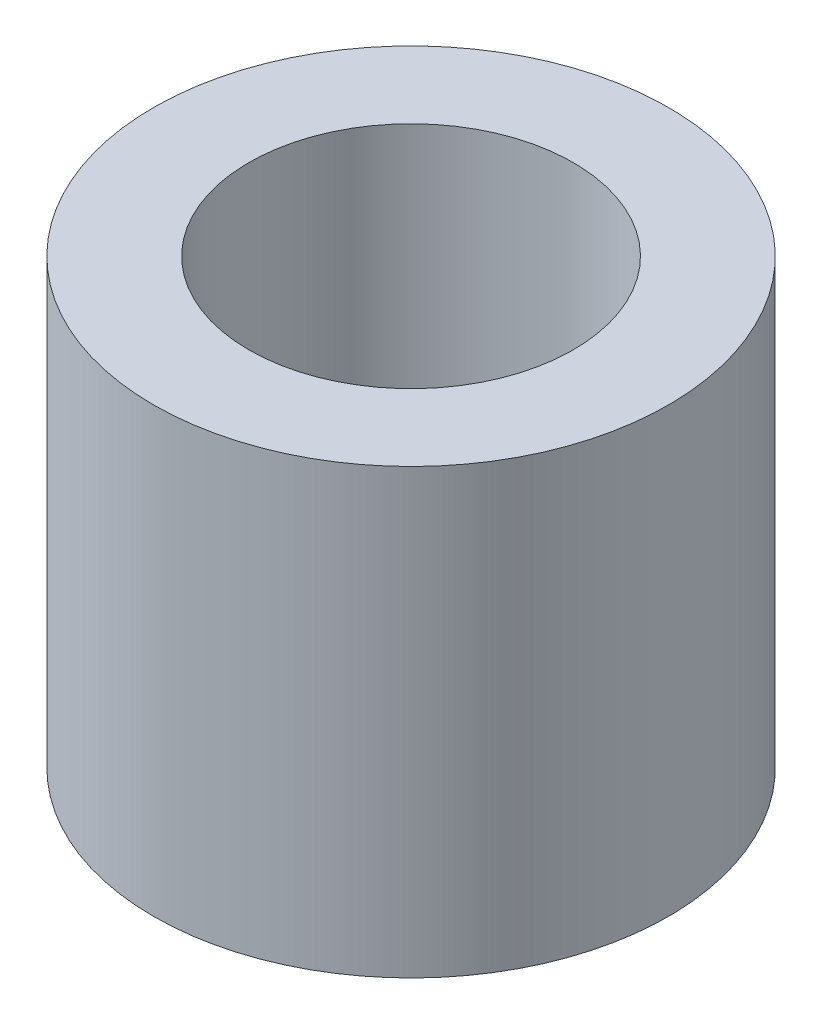
from build123d import *

# Parameters (mm, degrees)
SKETCH2_R           = 6.35
SKETCH2_R_2         = 4
BOSS_EXTRUDE1_DEPTH = 10.922


with BuildPart() as part:
    # Sketch2 → Boss-Extrude1 (new body)
    with BuildSketch(Plane(origin=(0, 0, 0), x_dir=(1, 0, 0), z_dir=(0, 1, 0))):
        with Locations(Location((0, 0, 0), (0, 0, 270))):
            Circle(SKETCH2_R)
        with Locations(Location((0, 0, 0), (0, 0, 270))):
            Circle(SKETCH2_R_2, mode=Mode.SUBTRACT)
    extrude(amount=BOSS_EXTRUDE1_DEPTH)


solid = part.part
